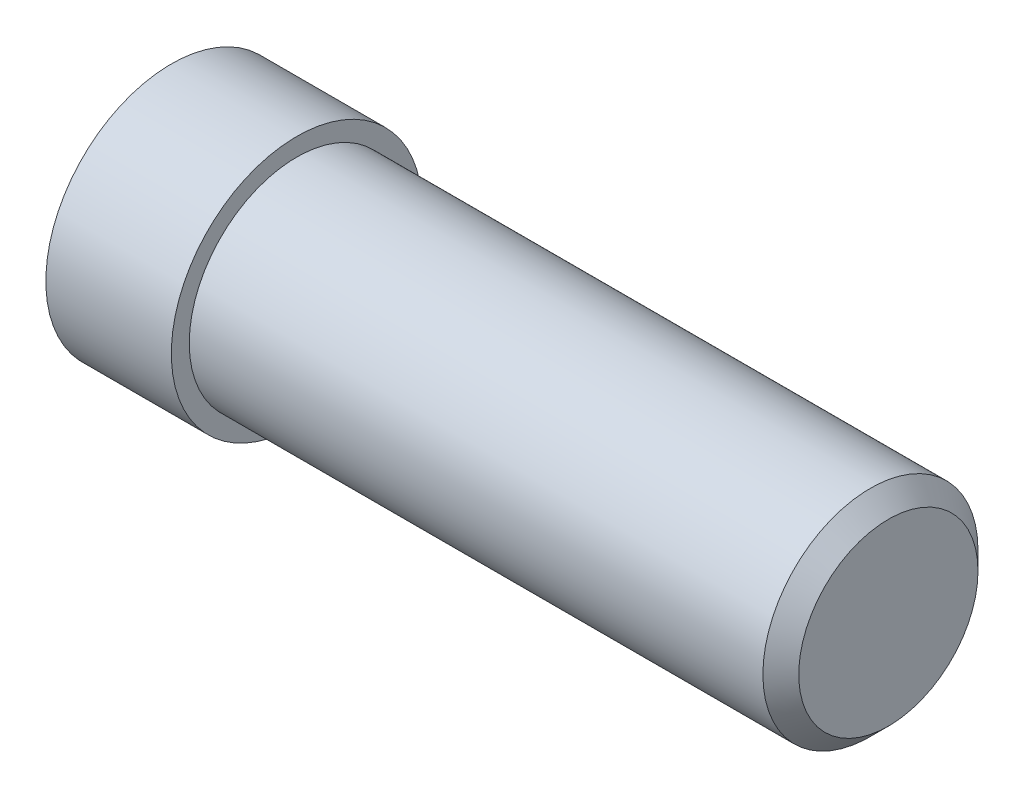
from build123d import *

# Parameters (mm, degrees)
CHAMFER1_SIZE = 25.4


with BuildPart() as part:
    # Sketch1 → Revolve1 (revolve)
    with BuildSketch(Plane(origin=(0, 0, 0), x_dir=(1, 0, 0), z_dir=(0, 1, 0))):
        Polygon((0, 0), (-1016, 0), (-1016, 177.8), (-838.2, 177.8), (-838.2, 152.4), (0, 152.4), align=None)
    revolve(axis=Axis((0, 0, 0), (-1, 0, 0)))

    # Chamfer1
    chamfer1_edges = [part.edges().sort_by_distance(p)[0] for p in [
        (0, 0, 152.4),
    ]]
    chamfer(chamfer1_edges, length=CHAMFER1_SIZE)


solid = part.part
